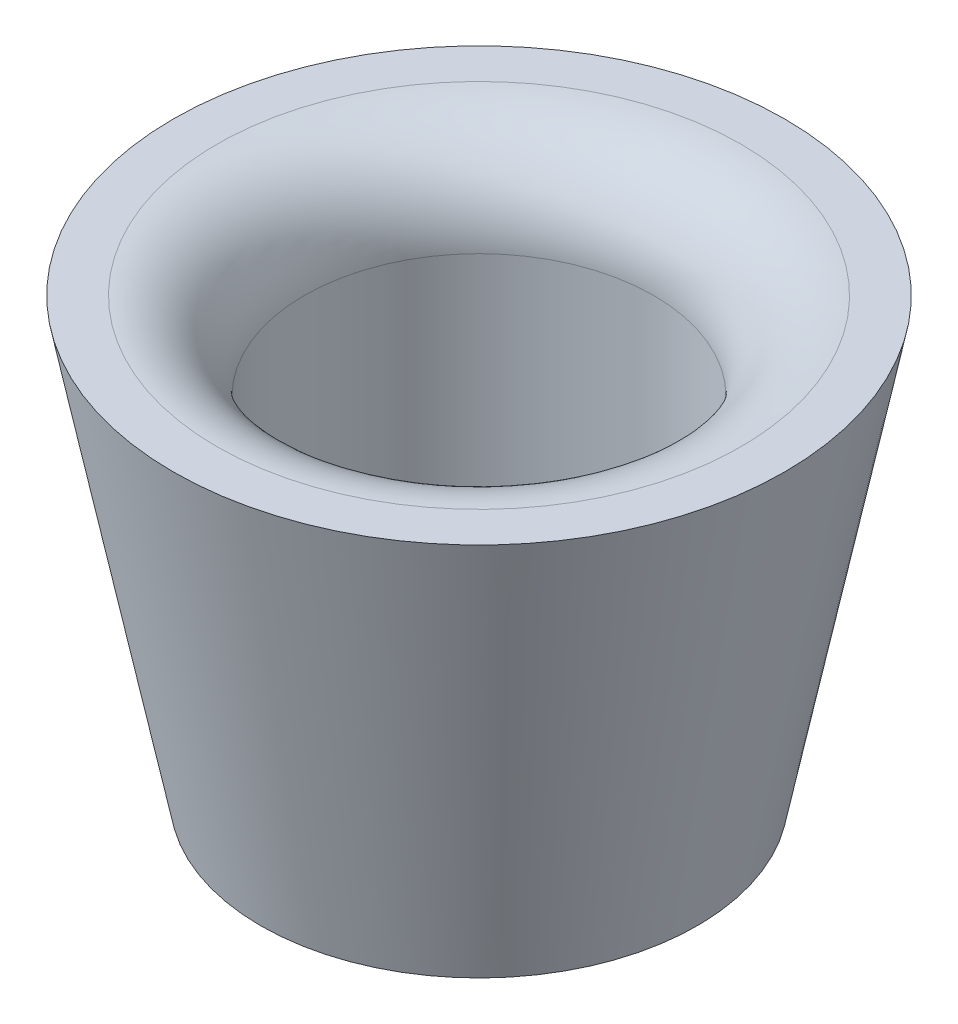
from build123d import *

# Parameters (mm, degrees)
FILLET1_R = 2


with BuildPart() as part:
    # Sketch1 → Revolve1 (revolve)
    with BuildSketch(Plane.XY, mode=Mode.PRIVATE) as revolve1_sk:
        Polygon((5, 0), (7, 10), (4, 10), (4, 0), align=None)
    revolve(revolve1_sk.sketch.rotate(Axis((0, 15.75, 0), (0, -1, 0)), 90), axis=Axis((0, 15.75, 0), (0, -1, 0)))

    # Fillet1
    fillet1_edges = [part.edges().sort_by_distance(p)[0] for p in [
        (0, 10, -4),
    ]]
    fillet(fillet1_edges, radius=FILLET1_R)


solid = part.part
